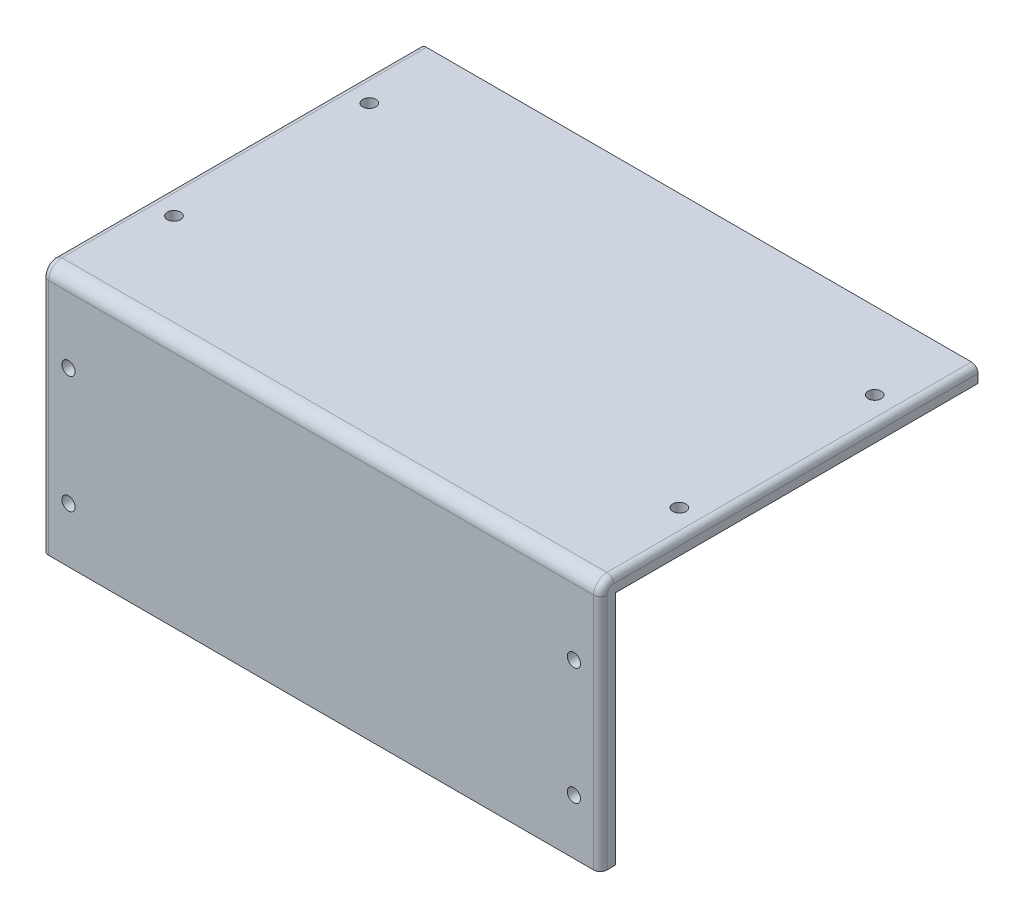
from build123d import *

# Parameters (mm, degrees)
SKETCH1_W           = 127
SKETCH1_H           = 53.65
BOSS_EXTRUDE1_DEPTH = 3.5
BOSS_EXTRUDE3_DEPTH = 127
SKETCH4_R           = 1.5
CUT_EXTRUDE1_DEPTH  = 3.5
SKETCH6_R           = 1.5
CUT_EXTRUDE3_DEPTH  = 3.5
FILLET1_R           = 1.5
FILLET2_R           = 1.5


with BuildPart() as part:
    # Sketch1 → Boss-Extrude1 (new body)
    with BuildSketch(Plane.XY):
        with Locations((63.5, 26.825)):
            Rectangle(SKETCH1_W, SKETCH1_H)
    extrude(amount=BOSS_EXTRUDE1_DEPTH)

    # Sketch2 → Boss-Extrude3 (add)
    with BuildSketch(Plane.ZY):
        with BuildLine():
            Line((3.5, 53.65), (3.5, 54.15))
            ThreePointArc((3.5, 54.15), (2.621320344, 56.271320344), (0.5, 57.15))
            Line((0.5, 57.15), (-82.44, 57.15))
            Line((-82.44, 57.15), (-82.44, 53.65))
            Line((-82.44, 53.65), (0, 53.65))
            Line((0, 53.65), (3.5, 53.65))
        make_face()
    extrude(amount=-BOSS_EXTRUDE3_DEPTH)

    # Sketch4 → Cut-Extrude1 (cut)
    with BuildSketch(Plane(origin=(0, 0, 0), x_dir=(-1, 0, 0), z_dir=(0, 0, -1))):
        with Locations((-121, 39.15)):
            Circle(SKETCH4_R)
        with Locations((-121, 12.5)):
            Circle(SKETCH4_R)
        with Locations(Location((-6, 12.5, 0), (0, 0, 180))):
            Circle(SKETCH4_R)
        with Locations(Location((-6, 39.15, 0), (0, 0, 180))):
            Circle(SKETCH4_R)
    extrude(amount=-CUT_EXTRUDE1_DEPTH, mode=Mode.SUBTRACT)

    # Sketch6 → Cut-Extrude3 (cut)
    with BuildSketch(Plane.XZ.offset(-53.65)):
        with Locations(Location((6, -20.5, 0), (0, 0, 270))):
            Circle(SKETCH6_R)
        with Locations(Location((6, -64.94, 0), (0, 0, 270))):
            Circle(SKETCH6_R)
        with Locations(Location((121, -64.94, 0), (0, 0, 90))):
            Circle(SKETCH6_R)
        with Locations(Location((121, -20.5, 0), (0, 0, 90))):
            Circle(SKETCH6_R)
    extrude(amount=-CUT_EXTRUDE3_DEPTH, mode=Mode.SUBTRACT)

    # Fillet1
    fillet1_edges = [part.edges().sort_by_distance(p)[0] for p in [
        (127, 27.075, 3.5),
        (127, 57.15, -40.97),
        (127, 56.271320344, 2.621320344),
    ]]
    fillet(fillet1_edges, radius=FILLET1_R)

    # Fillet2
    fillet2_edges = [part.edges().sort_by_distance(p)[0] for p in [
        (0, 56.271320344, 2.621320344),
        (0, 57.15, -40.97),
        (0, 27.075, 3.5),
    ]]
    fillet(fillet2_edges, radius=FILLET2_R)


solid = part.part
